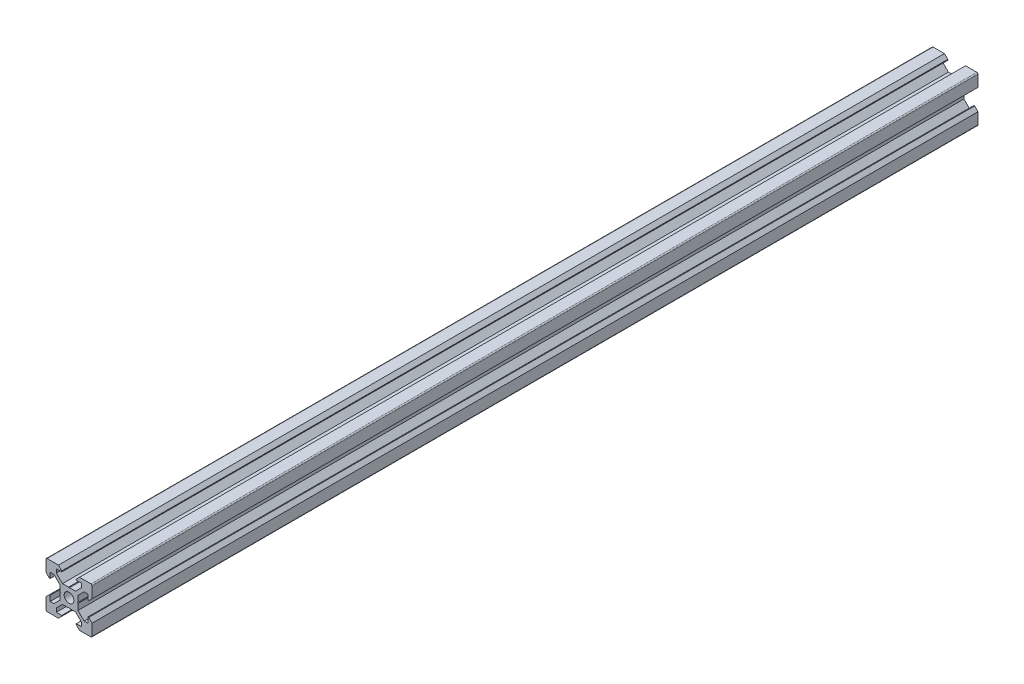
from build123d import *

# Parameters (mm, degrees)
SKETCH1_R           = 2.1
BOSS_EXTRUDE1_DEPTH = 385


with BuildPart() as part:
    # Sketch1 → Boss-Extrude1 (new body)
    with BuildSketch(Plane.XY):
        with BuildLine():
            Line((4.58, -10), (9.5, -10))
            ThreePointArc((9.5, -10), (9.853553391, -9.853553391), (10, -9.5))
            Line((10, -9.5), (10, -4.58))
            Line((10, -4.58), (8.545, -3.125))
            Line((8.545, -3.125), (8.2, -3.125))
            Line((8.2, -3.125), (8.2, -5.5))
            Line((8.2, -5.5), (6.560660172, -5.5))
            Line((6.560660172, -5.5), (3.9, -2.839339828))
            Line((3.9, -2.839339828), (3.9, -0.21))
            Line((3.9, -0.21), (3.69, 0))
            Line((3.69, 0), (3.9, 0.21))
            Line((3.9, 0.21), (3.9, 2.839339828))
            Line((3.9, 2.839339828), (6.560660172, 5.5))
            Line((6.560660172, 5.5), (8.2, 5.5))
            Line((8.2, 5.5), (8.2, 3.125))
            Line((8.2, 3.125), (8.545, 3.125))
            Line((8.545, 3.125), (10, 4.58))
            Line((10, 4.58), (10, 9.5))
            ThreePointArc((10, 9.5), (9.853553391, 9.853553391), (9.5, 10))
            Line((9.5, 10), (4.58, 10))
            Line((4.58, 10), (3.125, 8.545))
            Line((3.125, 8.545), (3.125, 8.2))
            Line((3.125, 8.2), (5.5, 8.2))
            Line((5.5, 8.2), (5.5, 6.560660172))
            Line((5.5, 6.560660172), (2.839339828, 3.9))
            Line((2.839339828, 3.9), (0.21, 3.9))
            Line((0.21, 3.9), (0, 3.69))
            Line((0, 3.69), (-0.21, 3.9))
            Line((-0.21, 3.9), (-2.839339828, 3.9))
            Line((-2.839339828, 3.9), (-5.5, 6.560660172))
            Line((-5.5, 6.560660172), (-5.5, 8.2))
            Line((-5.5, 8.2), (-3.125, 8.2))
            Line((-3.125, 8.2), (-3.125, 8.545))
            Line((-3.125, 8.545), (-4.58, 10))
            Line((-4.58, 10), (-9.5, 10))
            ThreePointArc((-9.5, 10), (-9.853553391, 9.853553391), (-10, 9.5))
            Line((-10, 9.5), (-10, 4.58))
            Line((-10, 4.58), (-8.545, 3.125))
            Line((-8.545, 3.125), (-8.2, 3.125))
            Line((-8.2, 3.125), (-8.2, 5.5))
            Line((-8.2, 5.5), (-6.560660172, 5.5))
            Line((-6.560660172, 5.5), (-3.9, 2.839339828))
            Line((-3.9, 2.839339828), (-3.9, 0.21))
            Line((-3.9, 0.21), (-3.69, 0))
            Line((-3.69, 0), (-3.9, -0.21))
            Line((-3.9, -0.21), (-3.9, -2.839339828))
            Line((-3.9, -2.839339828), (-6.560660172, -5.5))
            Line((-6.560660172, -5.5), (-8.2, -5.5))
            Line((-8.2, -5.5), (-8.2, -3.125))
            Line((-8.2, -3.125), (-8.545, -3.125))
            Line((-8.545, -3.125), (-10, -4.58))
            Line((-10, -4.58), (-10, -9.5))
            ThreePointArc((-10, -9.5), (-9.853553391, -9.853553391), (-9.5, -10))
            Line((-9.5, -10), (-4.58, -10))
            Line((-4.58, -10), (-3.125, -8.545))
            Line((-3.125, -8.545), (-3.125, -8.2))
            Line((-3.125, -8.2), (-5.5, -8.2))
            Line((-5.5, -8.2), (-5.5, -6.560660172))
            Line((-5.5, -6.560660172), (-2.839339828, -3.9))
            Line((-2.839339828, -3.9), (-0.21, -3.9))
            Line((-0.21, -3.9), (0, -3.69))
            Line((0, -3.69), (0.21, -3.9))
            Line((0.21, -3.9), (2.839339828, -3.9))
            Line((2.839339828, -3.9), (5.5, -6.560660172))
            Line((5.5, -6.560660172), (5.5, -8.2))
            Line((5.5, -8.2), (3.125, -8.2))
            Line((3.125, -8.2), (3.125, -8.545))
            Line((3.125, -8.545), (4.58, -10))
        make_face()
        Circle(SKETCH1_R, mode=Mode.SUBTRACT)
    extrude(amount=BOSS_EXTRUDE1_DEPTH)


solid = part.part
